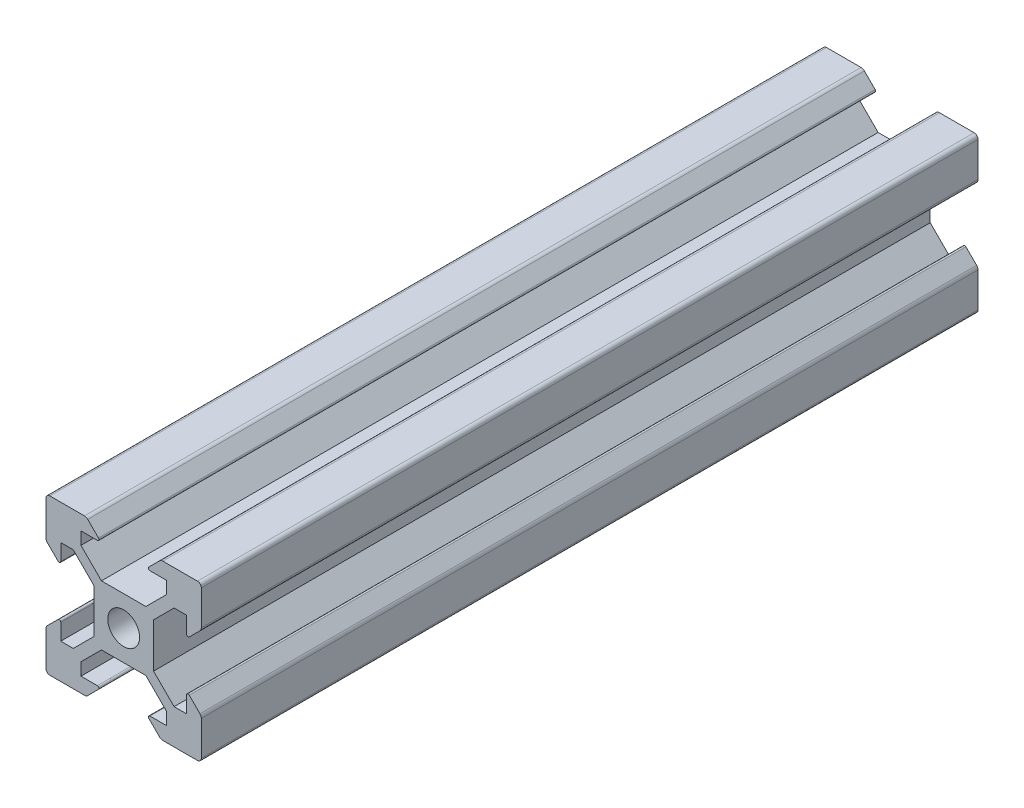
from build123d import *

# Parameters (mm, degrees)
SKETCH1_R           = 2.05
BOSS_EXTRUDE1_DEPTH = 100


with BuildPart() as part:
    # Sketch1 → Boss-Extrude1 (new body)
    with BuildSketch(Plane(origin=(0, 0, 0), x_dir=(0, 1, 0), z_dir=(0, 0, 1))):
        with BuildLine():
            Line((-2.860050506, -3.85), (2.860050506, -3.85))
            Line((2.860050506, -3.85), (5.5, -6.489949494))
            Line((5.5, -6.489949494), (5.5, -8.1))
            Line((5.5, -8.1), (3.382842712, -8.1))
            ThreePointArc((3.382842712, -8.1), (3.198066806, -8.223463314), (3.241421356, -8.441421356))
            Line((3.241421356, -8.441421356), (4.624264069, -9.824264069))
            ThreePointArc((4.624264069, -9.824264069), (4.818918078, -9.95432772), (5.048528137, -10))
            Line((5.048528137, -10), (9.5, -10))
            ThreePointArc((9.5, -10), (9.853553391, -9.853553391), (10, -9.5))
            Line((10, -9.5), (10, -5.048528137))
            ThreePointArc((10, -5.048528137), (9.95432772, -4.818918078), (9.824264069, -4.624264069))
            Line((9.824264069, -4.624264069), (8.441421356, -3.241421356))
            ThreePointArc((8.441421356, -3.241421356), (8.223463314, -3.198066806), (8.1, -3.382842712))
            Line((8.1, -3.382842712), (8.1, -5.5))
            Line((8.1, -5.5), (6.489949494, -5.5))
            Line((6.489949494, -5.5), (3.85, -2.860050506))
            Line((3.85, -2.860050506), (3.85, 2.860050506))
            Line((3.85, 2.860050506), (6.489949494, 5.5))
            Line((6.489949494, 5.5), (8.1, 5.5))
            Line((8.1, 5.5), (8.1, 3.382842712))
            ThreePointArc((8.1, 3.382842712), (8.223463314, 3.198066806), (8.441421356, 3.241421356))
            Line((8.441421356, 3.241421356), (9.824264069, 4.624264069))
            ThreePointArc((9.824264069, 4.624264069), (9.95432772, 4.818918078), (10, 5.048528137))
            Line((10, 5.048528137), (10, 9.5))
            ThreePointArc((10, 9.5), (9.853553391, 9.853553391), (9.5, 10))
            Line((9.5, 10), (5.048528137, 10))
            ThreePointArc((5.048528137, 10), (4.818918078, 9.95432772), (4.624264069, 9.824264069))
            Line((4.624264069, 9.824264069), (3.241421356, 8.441421356))
            ThreePointArc((3.241421356, 8.441421356), (3.198066806, 8.223463314), (3.382842712, 8.1))
            Line((3.382842712, 8.1), (5.5, 8.1))
            Line((5.5, 8.1), (5.5, 6.489949494))
            Line((5.5, 6.489949494), (2.860050506, 3.85))
            Line((2.860050506, 3.85), (-2.860050506, 3.85))
            Line((-2.860050506, 3.85), (-5.5, 6.489949494))
            Line((-5.5, 6.489949494), (-5.5, 8.1))
            Line((-5.5, 8.1), (-3.382842712, 8.1))
            ThreePointArc((-3.382842712, 8.1), (-3.198066806, 8.223463314), (-3.241421356, 8.441421356))
            Line((-3.241421356, 8.441421356), (-4.624264069, 9.824264069))
            ThreePointArc((-4.624264069, 9.824264069), (-4.818918078, 9.95432772), (-5.048528137, 10))
            Line((-5.048528137, 10), (-9.5, 10))
            ThreePointArc((-9.5, 10), (-9.853553391, 9.853553391), (-10, 9.5))
            Line((-10, 9.5), (-10, 5.048528137))
            ThreePointArc((-10, 5.048528137), (-9.95432772, 4.818918078), (-9.824264069, 4.624264069))
            Line((-9.824264069, 4.624264069), (-8.441421356, 3.241421356))
            ThreePointArc((-8.441421356, 3.241421356), (-8.223463314, 3.198066806), (-8.1, 3.382842712))
            Line((-8.1, 3.382842712), (-8.1, 5.5))
            Line((-8.1, 5.5), (-6.489949494, 5.5))
            Line((-6.489949494, 5.5), (-3.85, 2.860050506))
            Line((-3.85, 2.860050506), (-3.85, -2.860050506))
            Line((-3.85, -2.860050506), (-6.489949494, -5.5))
            Line((-6.489949494, -5.5), (-8.1, -5.5))
            Line((-8.1, -5.5), (-8.1, -3.382842712))
            ThreePointArc((-8.1, -3.382842712), (-8.223463314, -3.198066806), (-8.441421356, -3.241421356))
            Line((-8.441421356, -3.241421356), (-9.824264069, -4.624264069))
            ThreePointArc((-9.824264069, -4.624264069), (-9.95432772, -4.818918078), (-10, -5.048528137))
            Line((-10, -5.048528137), (-10, -9.5))
            ThreePointArc((-10, -9.5), (-9.853553391, -9.853553391), (-9.5, -10))
            Line((-9.5, -10), (-5.048528137, -10))
            ThreePointArc((-5.048528137, -10), (-4.818918078, -9.95432772), (-4.624264069, -9.824264069))
            Line((-4.624264069, -9.824264069), (-3.241421356, -8.441421356))
            ThreePointArc((-3.241421356, -8.441421356), (-3.198066806, -8.223463314), (-3.382842712, -8.1))
            Line((-3.382842712, -8.1), (-5.5, -8.1))
            Line((-5.5, -8.1), (-5.5, -6.489949494))
            Line((-5.5, -6.489949494), (-2.860050506, -3.85))
        make_face()
        with Locations(Location((0, 0, 0), (0, 0, 270))):
            Circle(SKETCH1_R, mode=Mode.SUBTRACT)
    extrude(amount=BOSS_EXTRUDE1_DEPTH)


solid = part.part
